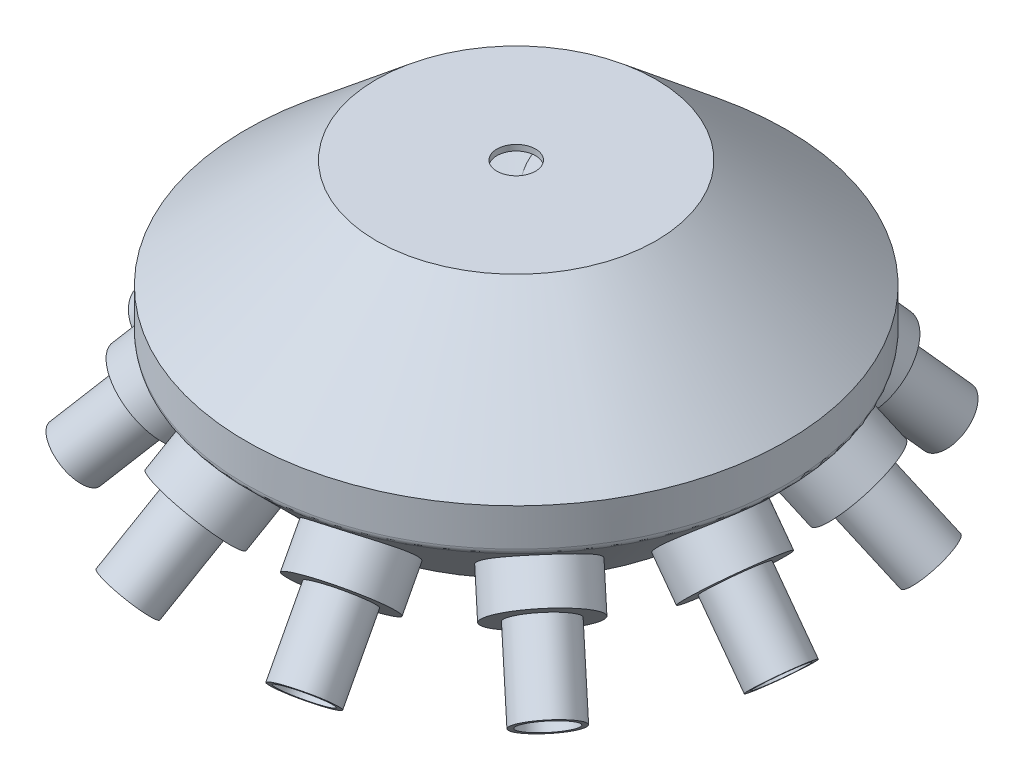
from build123d import *

# Parameters (mm, degrees)
SHELL1_T            = 3.81
FILLET2_R           = 5.08
BOSS_EXTRUDE1_START = -6.35
SKETCH4_R           = 30.1625
BOSS_EXTRUDE1_DEPTH = 31.75
SKETCH5_R           = 19.05
SKETCH5_R_2         = 15.875
BOSS_EXTRUDE2_DEPTH = 50.8
CIRPATTERN2_COUNT   = 11
SKETCH6_R           = 12.7
CUT_EXTRUDE1_DEPTH  = 364.372531732


with BuildPart() as part:
    # Sketch1 → Revolve1 (revolve)
    with BuildSketch(Plane.XY, mode=Mode.PRIVATE) as revolve1_sk:
        Polygon((0, 147.6375), (0, 0), (128.408591334, 0), (177.8, 49.391408666), (177.8, 76.2), (92.075, 147.6375), align=None)
    revolve(revolve1_sk.sketch.rotate(Axis((0, -40.168696884, 0), (0, 1, 0)), 90), axis=Axis((0, -40.168696884, 0), (0, 1, 0)))

    # Shell1 (no face opened: a closed hollow body)
    add(offset(amount=-SHELL1_T, mode=Mode.PRIVATE), mode=Mode.SUBTRACT)

    # Fillet2
    fillet2_edges = [part.edges().sort_by_distance(p)[0] for p in [
        (0, 49.391408666, 177.8),
    ]]
    fillet(fillet2_edges, radius=FILLET2_R)

    # Sketch4 → Boss-Extrude1 (add)
    with BuildSketch(Plane(origin=(0, -64.204295667, -64.204295667), x_dir=(-1, 0, 0), z_dir=(0, -0.7071067811865465, -0.7071067811865488)).offset(BOSS_EXTRUDE1_START)):
        with Locations(Location((0, 124.254380798, 0), (0, 0, 90))):
            Circle(SKETCH4_R)
    boss_extrude1 = extrude(amount=BOSS_EXTRUDE1_DEPTH)

    # Sketch5 → Boss-Extrude2 (add)
    with BuildSketch(Plane(origin=(0, -82.164807909, -82.164807909), x_dir=(1, 0, 0), z_dir=(0, -0.7071067811865465, -0.7071067811865486))):
        with Locations(Location((0, -124.254380798, 0), (0, 0, 270))):
            Circle(SKETCH5_R)
        with Locations(Location((0, -124.254380798, 0), (0, 0, 270))):
            Circle(SKETCH5_R_2, mode=Mode.SUBTRACT)
    boss_extrude2 = extrude(amount=BOSS_EXTRUDE2_DEPTH)

    # CirPattern2: Boss-Extrude1, Boss-Extrude2 ×11 about axis
    cirpattern2_axis = Axis((0, 0, 0), (0, 1, 0))
    add([boss_extrude1.rotate(cirpattern2_axis, i * 360 / CIRPATTERN2_COUNT) for i in range(1, CIRPATTERN2_COUNT)])
    add([boss_extrude2.rotate(cirpattern2_axis, i * 360 / CIRPATTERN2_COUNT) for i in range(1, CIRPATTERN2_COUNT)])

    # Sketch6 → Cut-Extrude1 (cut, through all)
    with BuildSketch(Plane(origin=(0, 147.6375, 0), x_dir=(1, 0, 0), z_dir=(0, 1, 0))):
        with Locations(Location((0, 0, 0), (0, 0, 270))):
            Circle(SKETCH6_R)
    extrude(amount=-CUT_EXTRUDE1_DEPTH, mode=Mode.SUBTRACT)


solid = part.part
